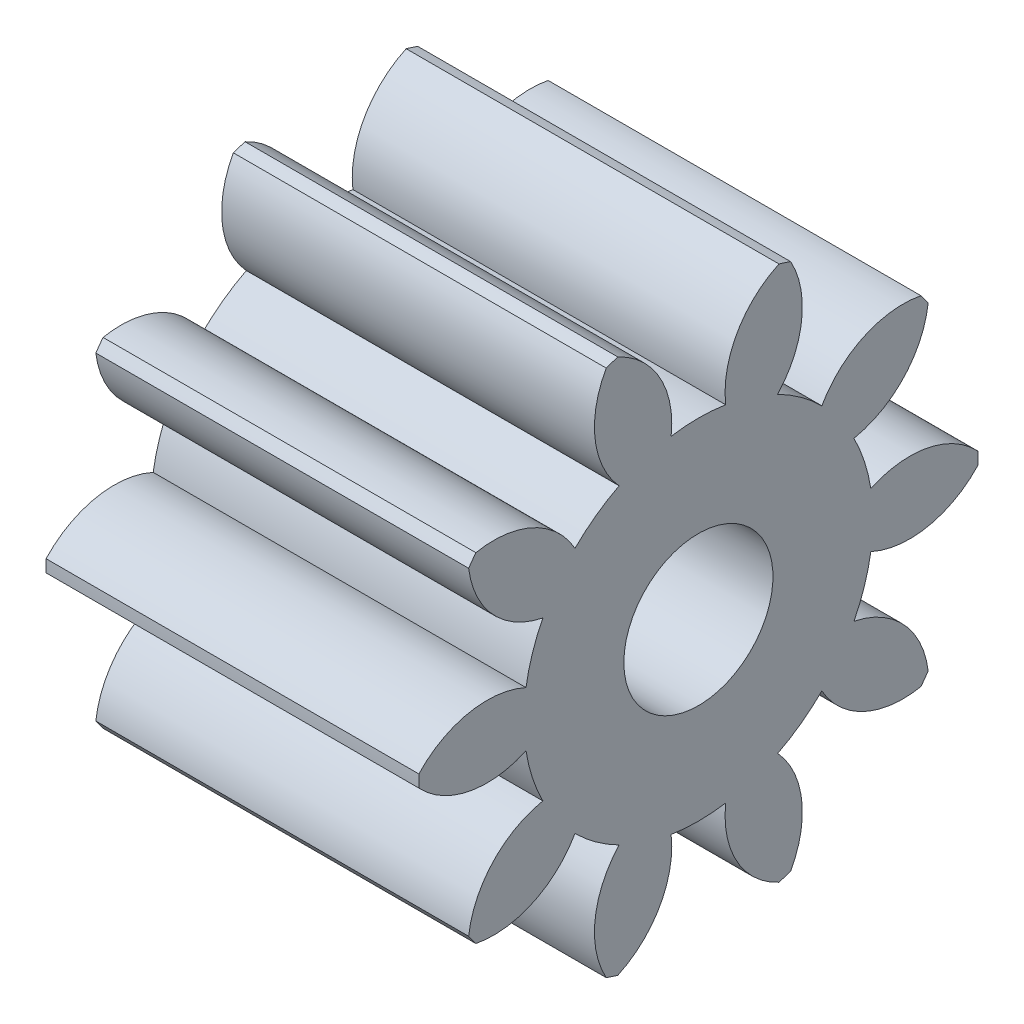
from build123d import *

# Parameters (mm, degrees)
BASPROSKE_W     = 2
BASPROSKE_H     = 1.5
TOOTHCUT_DEPTH  = 3.915475947
TEETHCUTS_COUNT = 10
TEETHCUTS_ANGLE = 324
BORSKE_R        = 0.4
BORE_DEPTH      = 50.0000508


with BuildPart() as part:
    # BasProSke → Base-Revolve (revolve)
    with BuildSketch(Plane(origin=(0, 0, 0), x_dir=(1, 0, 0), z_dir=(0, 1, 0)), mode=Mode.PRIVATE) as base_revolve_sk:
        with Locations((1, 0.75)):
            Rectangle(BASPROSKE_W, BASPROSKE_H)
    revolve(base_revolve_sk.sketch.rotate(Axis((-10, 0, 0), (1, 0, 0)), 180), axis=Axis((-10, 0, 0), (1, 0, 0)))

    # TooCutSke → ToothCut (cut, through all)
    with BuildSketch(Plane(origin=(0, 0, 0), x_dir=(0, 0, -1), z_dir=(1, 0, 0))):
        with BuildLine():
            ThreePointArc((0.146321185, 0.924998573), (0, 0.9365), (-0.146321185, 0.924998573))
            ThreePointArc((-0.146321185, 0.924998573), (-0.216454601, 1.244005636), (-0.468585949, 1.451644712))
            ThreePointArc((-0.468585949, 1.451644712), (0, 1.5254), (0.468585949, 1.451644712))
            ThreePointArc((0.468585949, 1.451644712), (0.216454601, 1.244005636), (0.146321185, 0.924998573))
        make_face()
    toothcut = extrude(amount=TOOTHCUT_DEPTH, mode=Mode.SUBTRACT)

    # TeethCuts: ToothCut ×10 about axis
    teethcuts_axis = Axis((-10, 0, 0), (1, 0, 0))
    for i in range(1, TEETHCUTS_COUNT):
        add(toothcut.rotate(teethcuts_axis, i * TEETHCUTS_ANGLE / (TEETHCUTS_COUNT - 1)), mode=Mode.SUBTRACT)

    # BorSke → Bore (cut, symmetric)
    with BuildSketch(Plane(origin=(0, 0, 0), x_dir=(0, 0, -1), z_dir=(1, 0, 0))):
        with Locations(Location((0, 0, 0), (0, 0, 180))):
            Circle(BORSKE_R)
    extrude(amount=BORE_DEPTH, both=True, mode=Mode.SUBTRACT)


solid = part.part
